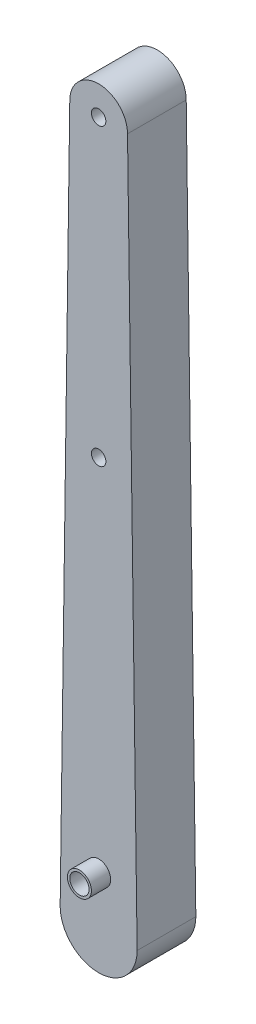
from build123d import *

# Parameters (mm, degrees)
SKETCH2_R           = 1.5
BOSS_EXTRUDE1_DEPTH = 12.2
SKETCH3_R           = 2.5
BOSS_EXTRUDE2_DEPTH = 4
SKETCH4_R           = 2
CUT_EXTRUDE1_DEPTH  = 2
SKETCH5_R           = 2
CUT_EXTRUDE2_DEPTH  = 20
SKETCH7_R           = 1.5
CUT_EXTRUDE3_DEPTH  = 20


with BuildPart() as part:
    # Sketch2 → Boss-Extrude1 (new body)
    with BuildSketch(Plane.XY):
        with BuildLine():
            Line((6, 76.358744395), (8, -69.641255605))
            ThreePointArc((8, -69.641255605), (0, -77.641255605), (-8, -69.641255605))
            Line((-8, -69.641255605), (-6, 76.358744395))
            ThreePointArc((-6, 76.358744395), (0, 82.358744395), (6, 76.358744395))
        make_face()
        with Locations((0, 76.358744395)):
            Circle(SKETCH2_R, mode=Mode.SUBTRACT)
    extrude(amount=BOSS_EXTRUDE1_DEPTH)


with BuildPart() as body_2:
    # Sketch3 → Boss-Extrude2 (new body)
    with BuildSketch(Plane.XY.offset(12.2)):
        with Locations((0, -59.641255605)):
            Circle(SKETCH3_R)
    extrude(amount=BOSS_EXTRUDE2_DEPTH)

    # Sketch4 → Cut-Extrude1 (cut)
    with BuildSketch(Plane.XY.offset(16.2)):
        with Locations((0, -59.641255605)):
            Circle(SKETCH4_R)
    extrude(amount=-CUT_EXTRUDE1_DEPTH, mode=Mode.SUBTRACT)


with BuildPart() as cut_extrude2_tool:
    # Sketch5 → Cut-Extrude2 (new body)
    with BuildSketch(Plane(origin=(0, 0, 0), x_dir=(-1, 0, 0), z_dir=(0, 0, -1))):
        with Locations(Location((0, -59.641255605, 0), (0, 0, 180))):
            Circle(SKETCH5_R)
    extrude(amount=-CUT_EXTRUDE2_DEPTH)


with BuildPart() as part_1:
    add(part.part)

    # Cut-Extrude2: cut by cut_extrude2_tool
    add(cut_extrude2_tool.part, mode=Mode.SUBTRACT)

    # Sketch7 → Cut-Extrude3 (cut)
    with BuildSketch(Plane.XY.offset(12.2)):
        with Locations((0, 15.110001993)):
            Circle(SKETCH7_R)
    extrude(amount=-CUT_EXTRUDE3_DEPTH, mode=Mode.SUBTRACT)


with BuildPart() as body_2_1:
    add(body_2.part)

    # Cut-Extrude2: cut by cut_extrude2_tool
    add(cut_extrude2_tool.part, mode=Mode.SUBTRACT)


solid = Compound([part_1.part, body_2_1.part])
